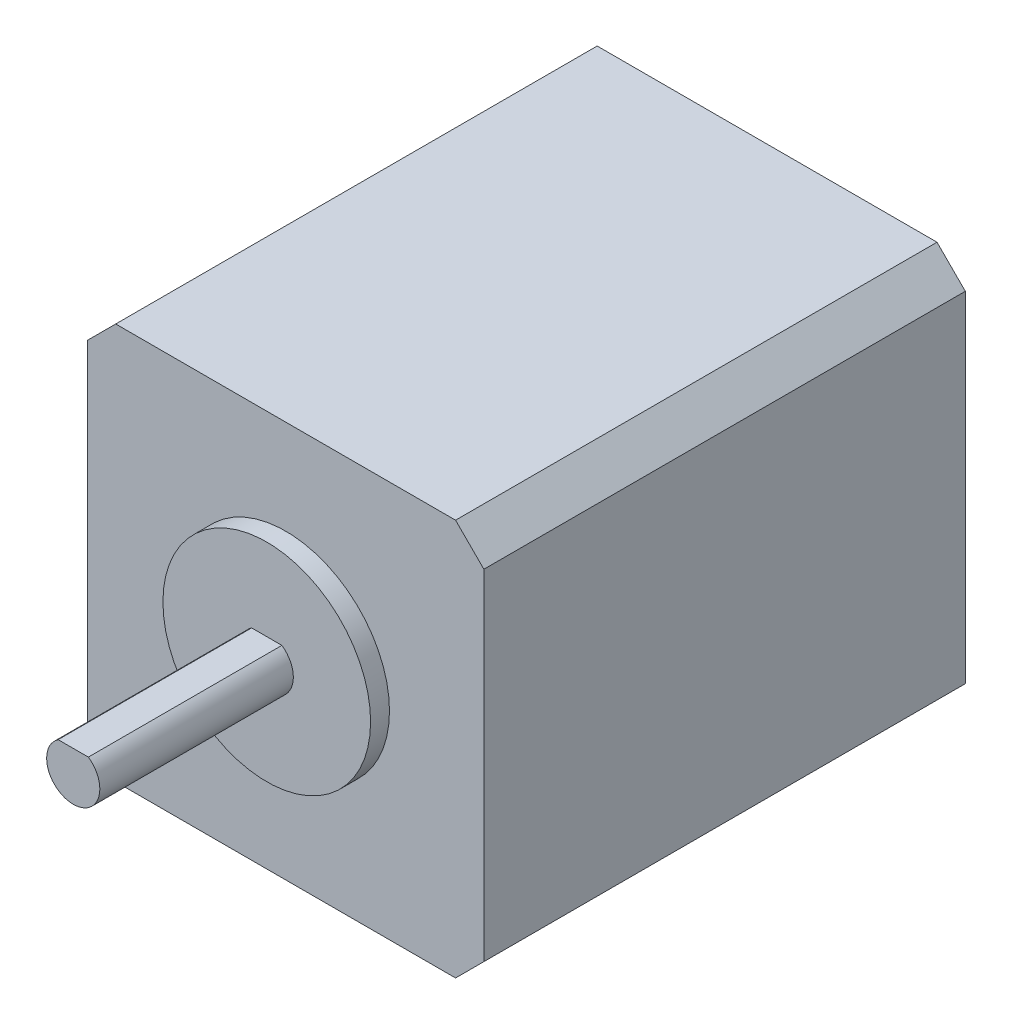
from build123d import *

# Parameters (mm, degrees)
SKETCH_1_W      = 42
SKETCH_1_H      = 42
EXTRUDE_1_DEPTH = 51
SKETCH_2_R      = 11
EXTRUDE_2_DEPTH = 2
EXTRUDE_3_DEPTH = 20.5
CHAMFER_1_SIZE  = 3


with BuildPart() as part:
    # 草图1 → 凸台-拉伸1 (new body)
    with BuildSketch(Plane.XY):
        Rectangle(SKETCH_1_W, SKETCH_1_H)
    extrude(amount=EXTRUDE_1_DEPTH)

    # 草图2 → 凸台-拉伸2 (add)
    with BuildSketch(Plane.XY.offset(51)):
        Circle(SKETCH_2_R)
    extrude(amount=EXTRUDE_2_DEPTH)

    # 草图3 → 凸台-拉伸3 (add)
    with BuildSketch(Plane.XY.offset(53)):
        with BuildLine():
            Line((-1.601826622, 2.315848528), (1.601826622, 2.315848528))
            ThreePointArc((1.601826622, 2.315848528), (0, -2.815848528), (-1.601826622, 2.315848528))
        make_face()
    extrude(amount=EXTRUDE_3_DEPTH)

    # 倒角1
    chamfer_1_edges = [part.edges().sort_by_distance(p)[0] for p in [
        (21, -21, 25.5),
        (-21, -21, 25.5),
        (-21, 21, 25.5),
        (21, 21, 25.5),
    ]]
    chamfer(chamfer_1_edges, length=CHAMFER_1_SIZE)


solid = part.part
